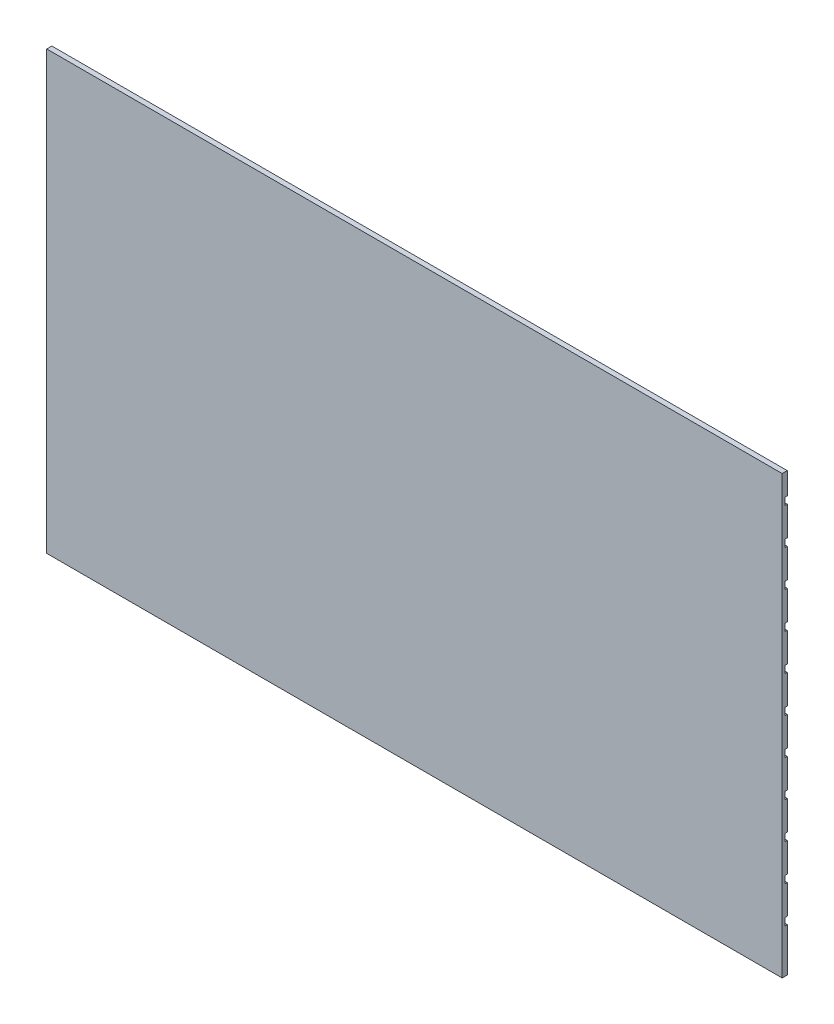
from build123d import *

# Parameters (mm, degrees)
SKETCH2_W           = 17.78
SKETCH2_H           = 1524
BOSS_EXTRUDE1_DEPTH = 2565.4
SKETCH3_W           = 2565.4
SKETCH3_H           = 25.4
CUT_EXTRUDE1_DEPTH  = 7.62


with BuildPart() as part:
    # Sketch2 → Boss-Extrude1 (new body)
    with BuildSketch(Plane(origin=(0, 0, 0), x_dir=(0, 0, -1), z_dir=(1, 0, 0))):
        with Locations((8.89, -762)):
            Rectangle(SKETCH2_W, SKETCH2_H)
    extrude(amount=BOSS_EXTRUDE1_DEPTH)

    # Sketch3 → Cut-Extrude1 (cut)
    with BuildSketch(Plane(origin=(0, 0, -17.78), x_dir=(-1, 0, 0), z_dir=(0, 0, -1))):
        with Locations((-1282.7, -88.9)):
            Rectangle(SKETCH3_W, SKETCH3_H)
        with Locations((-1282.7, -215.9)):
            Rectangle(SKETCH3_W, SKETCH3_H)
        with Locations((-1282.7, -342.9)):
            Rectangle(SKETCH3_W, SKETCH3_H)
        with Locations((-1282.7, -469.9)):
            Rectangle(SKETCH3_W, SKETCH3_H)
        with Locations((-1282.7, -596.9)):
            Rectangle(SKETCH3_W, SKETCH3_H)
        with Locations((-1282.7, -723.9)):
            Rectangle(SKETCH3_W, SKETCH3_H)
        with Locations((-1282.7, -850.9)):
            Rectangle(SKETCH3_W, SKETCH3_H)
        with Locations((-1282.7, -977.9)):
            Rectangle(SKETCH3_W, SKETCH3_H)
        with Locations((-1282.7, -1104.9)):
            Rectangle(SKETCH3_W, SKETCH3_H)
        with Locations((-1282.7, -1231.9)):
            Rectangle(SKETCH3_W, SKETCH3_H)
        with Locations((-1282.7, -1358.9)):
            Rectangle(SKETCH3_W, SKETCH3_H)
    extrude(amount=-CUT_EXTRUDE1_DEPTH, mode=Mode.SUBTRACT)


solid = part.part
